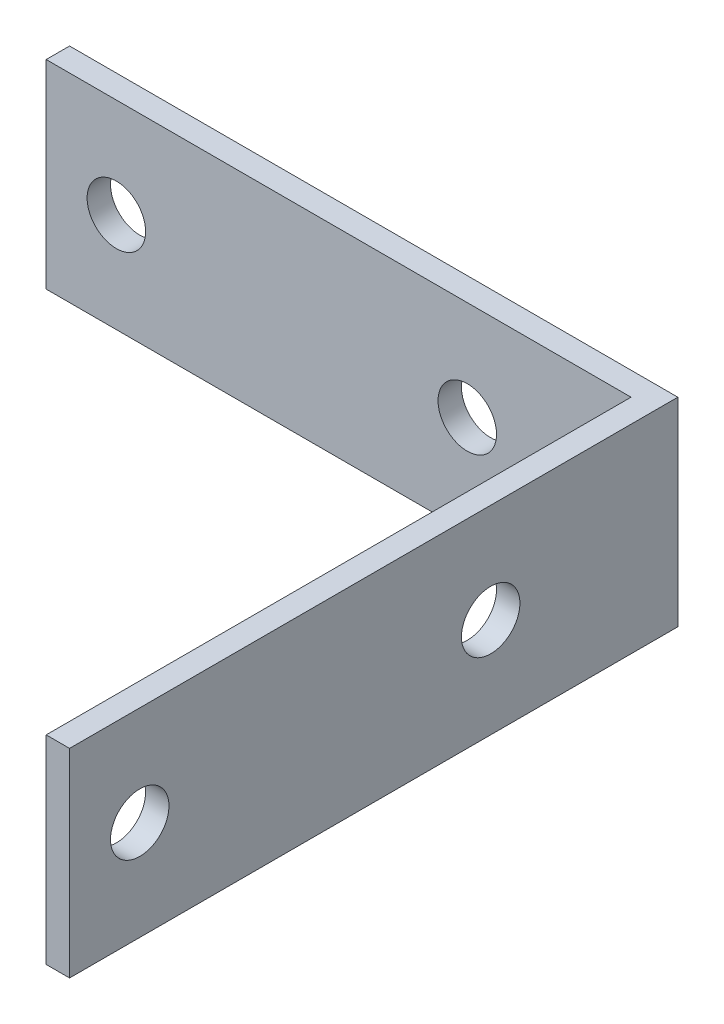
from build123d import *

# Parameters (mm, degrees)
ESQUISSE1_W             = 52
ESQUISSE1_H             = 17
BOSS_EXTRU_1_DEPTH      = 2
ESQUISSE2_W             = 2
ESQUISSE2_H             = 17
BOSS_EXTRU_2_DEPTH      = 50
ESQUISSE3_R             = 2.5
ENL_V_MAT_EXTRU_1_DEPTH = 50
ESQUISSE4_R             = 2.5
ENL_V_MAT_EXTRU_2_DEPTH = 50


with BuildPart() as part:
    # Esquisse1 → Boss.-Extru.1 (new body)
    with BuildSketch(Plane.XY):
        Rectangle(ESQUISSE1_W, ESQUISSE1_H)
    extrude(amount=BOSS_EXTRU_1_DEPTH)

    # Esquisse2 → Boss.-Extru.2 (add)
    with BuildSketch(Plane.XY.offset(2)):
        with Locations((25, 0)):
            Rectangle(ESQUISSE2_W, ESQUISSE2_H)
    extrude(amount=BOSS_EXTRU_2_DEPTH)

    # Esquisse3 → Enlèv. mat.-Extru.1 (cut)
    with BuildSketch(Plane.XY.offset(2)):
        with Locations((-20, 0)):
            Circle(ESQUISSE3_R)
        with Locations((10, 0)):
            Circle(ESQUISSE3_R)
    extrude(amount=-ENL_V_MAT_EXTRU_1_DEPTH, mode=Mode.SUBTRACT)

    # Esquisse4 → Enlèv. mat.-Extru.2 (cut)
    with BuildSketch(Plane.ZY.offset(-24)):
        with Locations((46, 0)):
            Circle(ESQUISSE4_R)
        with Locations((16, 0)):
            Circle(ESQUISSE4_R)
    extrude(amount=-ENL_V_MAT_EXTRU_2_DEPTH, mode=Mode.SUBTRACT)


solid = part.part
